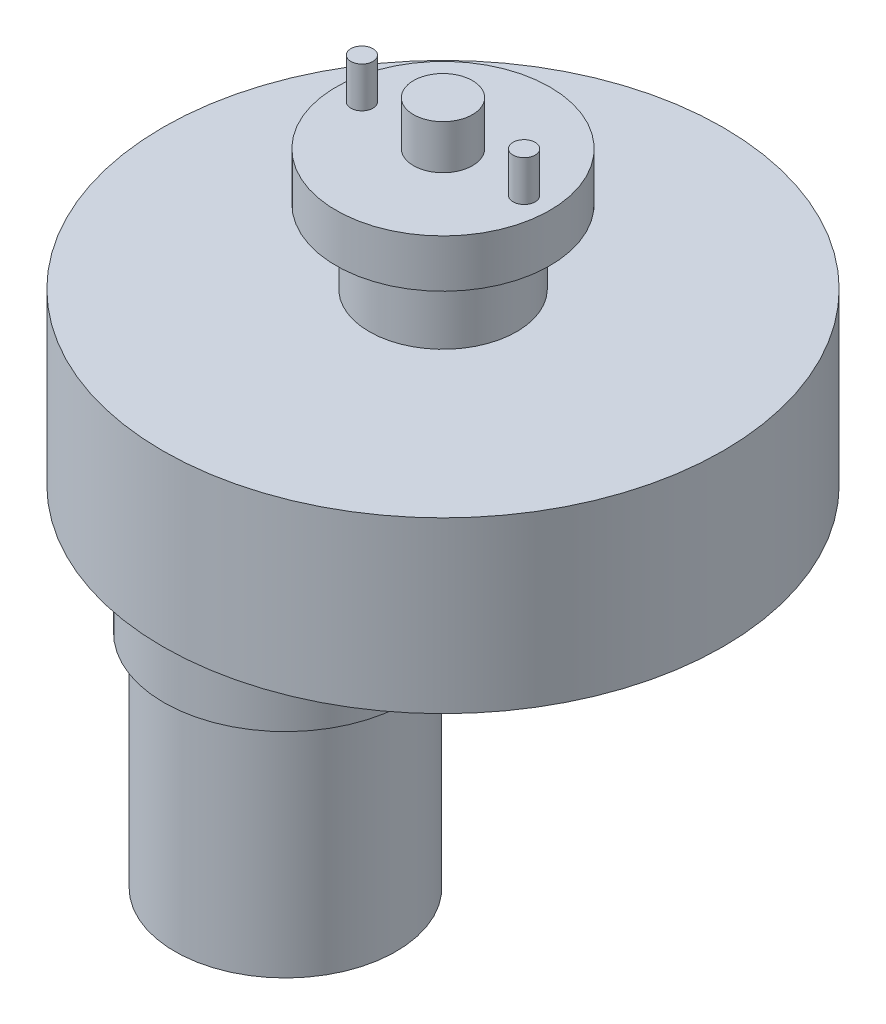
from build123d import *

# Parameters (mm, degrees)
SKETCH_1_R      = 38
EXTRUDE_1_DEPTH = 23
SKETCH_2_R      = 10
EXTRUDE_2_DEPTH = 10
SKETCH_3_R      = 14.5
EXTRUDE_3_DEPTH = 6.5
SKETCH_4_R      = 4
EXTRUDE_4_DEPTH = 6
SKETCH_5_R      = 1.5
EXTRUDE_5_DEPTH = 5.5
SKETCH_6_R      = 16.5
EXTRUDE_6_DEPTH = 28
SKETCH_7_R      = 15
EXTRUDE_7_DEPTH = 30


with BuildPart() as part:
    # Эскиз1 → Вытянуть1 (new body)
    with BuildSketch(Plane(origin=(0, 0, 0), x_dir=(1, 0, 0), z_dir=(0, 1, 0))):
        with Locations(Location((0, 0, 0), (0, 0, 270))):
            Circle(SKETCH_1_R)
    extrude(amount=EXTRUDE_1_DEPTH)

    # Эскиз2 → Вытянуть2 (add)
    with BuildSketch(Plane(origin=(0, 23, 0), x_dir=(1, 0, 0), z_dir=(0, 1, 0))):
        with Locations(Location((0, 0, 0), (0, 0, 270))):
            Circle(SKETCH_2_R)
    extrude(amount=EXTRUDE_2_DEPTH)

    # Эскиз3 → Вытянуть3 (add)
    with BuildSketch(Plane(origin=(0, 33, 0), x_dir=(1, 0, 0), z_dir=(0, 1, 0))):
        with Locations(Location((0, 0, 0), (0, 0, 90))):
            Circle(SKETCH_3_R)
    extrude(amount=EXTRUDE_3_DEPTH)

    # Эскиз4 → Вытянуть4 (add)
    with BuildSketch(Plane(origin=(0, 39.5, 0), x_dir=(-1, 0, 0), z_dir=(0, 1, 0))):
        with Locations(Location((0, 0, 0), (0, 0, 90))):
            Circle(SKETCH_4_R)
    extrude(amount=EXTRUDE_4_DEPTH)

    # Эскиз5 → Вытянуть5 (add)
    with BuildSketch(Plane(origin=(0, 39.5, 0), x_dir=(-1, 0, 0), z_dir=(0, 1, 0))):
        with Locations(Location((11, 0, 0), (0, 0, 90))):
            Circle(SKETCH_5_R)
        with Locations(Location((-11, 0, 0), (0, 0, 90))):
            Circle(SKETCH_5_R)
    extrude(amount=EXTRUDE_5_DEPTH)

    # Эскиз6 → Вытянуть6 (add)
    with BuildSketch(Plane.XZ):
        with Locations(Location((-21.372740523, 0, 0), (0, 0, 90))):
            Circle(SKETCH_6_R)
    extrude(amount=EXTRUDE_6_DEPTH)

    # Эскиз7 → Вытянуть7 (add)
    with BuildSketch(Plane.XZ.offset(28)):
        with Locations(Location((-21.372740523, 0, 0), (0, 0, 270))):
            Circle(SKETCH_7_R)
    extrude(amount=EXTRUDE_7_DEPTH)


solid = part.part
